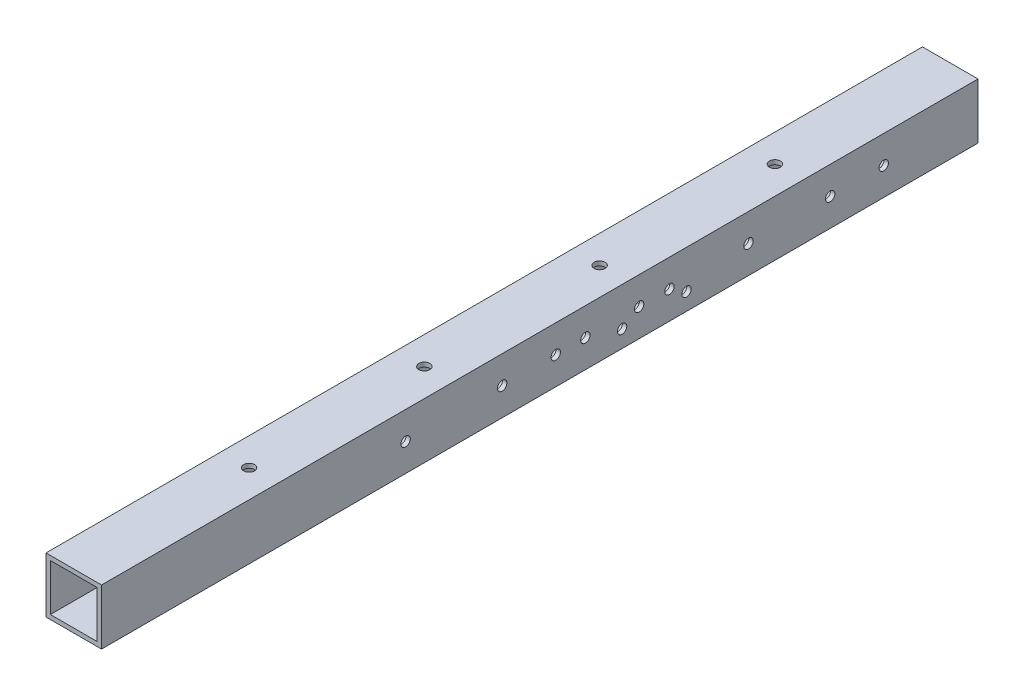
from build123d import *

# Parameters (mm, degrees)
SKETCH_1_W           = 25.4
SKETCH_1_H           = 25.4
EXTRUDE_1_DEPTH      = 400.8
SKETCH_1_3_W         = 21.4
SKETCH_1_3_H         = 21.4
CUT_EXTRUDE_1_DEPTH  = 402.202218339
SKETCH_2_R           = 2.15
CUT_EXTRUDE_2_DEPTH  = 3
SKETCH_3_R           = 2.15
CUT_EXTRUDE_3_DEPTH  = 3
SKETCH_4_R           = 2.15
CUT_EXTRUDE_4_DEPTH  = 3
SKETCH_5_R           = 2.149999993
CUT_EXTRUDE_5_DEPTH  = 5
SKETCH_6_R           = 2.15
CUT_EXTRUDE_6_DEPTH  = 5
SKETCH_7_R           = 2.15
CUT_EXTRUDE_7_DEPTH  = 5
SKETCH_8_R           = 2.15
CUT_EXTRUDE_8_DEPTH  = 5
SKETCH_9_R           = 2.15
CUT_EXTRUDE_9_DEPTH  = 5
SKETCH_10_R          = 2.15
CUT_EXTRUDE_10_DEPTH = 5
SKETCH_12_R          = 2.15
CUT_EXTRUDE_11_DEPTH = 5
SKETCH_13_R          = 2.15
CUT_EXTRUDE_12_DEPTH = 5
SKETCH_14_R          = 2.15
CUT_EXTRUDE_13_DEPTH = 5
SKETCH_15_R          = 2.15
CUT_EXTRUDE_14_DEPTH = 5
SKETCH_16_R          = 2.5
CUT_EXTRUDE_15_DEPTH = 10
SKETCH_17_R          = 2.5
CUT_EXTRUDE_16_DEPTH = 10


with BuildPart() as part:
    # 草圖1 → 填料-伸長1 (new body)
    with BuildSketch(Plane.XY):
        Rectangle(SKETCH_1_W, SKETCH_1_H)
    extrude(amount=EXTRUDE_1_DEPTH)

    # 草圖1<3> → 除料-伸長1 (cut, through all)
    with BuildSketch(Plane.XY):
        Rectangle(SKETCH_1_3_W, SKETCH_1_3_H)
    extrude(amount=CUT_EXTRUDE_1_DEPTH, mode=Mode.SUBTRACT)

    # 草圖2 → 除料-伸長2 (cut)
    with BuildSketch(Plane(origin=(12.7, 0, 0), x_dir=(0, 0, -1), z_dir=(1, 0, 0))):
        with Locations((-43.1, 0)):
            Circle(SKETCH_2_R)
        with Locations((-67.6, 0)):
            Circle(SKETCH_2_R)
    extrude(amount=-CUT_EXTRUDE_2_DEPTH, mode=Mode.SUBTRACT)

    # 草圖3 → 除料-伸長3 (cut)
    with BuildSketch(Plane.XZ.offset(12.7)):
        with Locations((0, 43.1)):
            Circle(SKETCH_3_R)
        with Locations((0, 67.6)):
            Circle(SKETCH_3_R)
    extrude(amount=-CUT_EXTRUDE_3_DEPTH, mode=Mode.SUBTRACT)

    # 草圖4 → 除料-伸長4 (cut)
    with BuildSketch(Plane(origin=(12.7, 0, 0), x_dir=(0, 0, -1), z_dir=(1, 0, 0))):
        with Locations((-104.95, 0)):
            Circle(SKETCH_4_R)
    extrude(amount=-CUT_EXTRUDE_4_DEPTH, mode=Mode.SUBTRACT)

    # 草圖5 → 除料-伸長5 (cut)
    with BuildSketch(Plane.XZ.offset(12.7)):
        with Locations((0, 104.95)):
            Circle(SKETCH_5_R)
    extrude(amount=-CUT_EXTRUDE_5_DEPTH, mode=Mode.SUBTRACT)

    # 草圖6 → 除料-伸長6 (cut)
    with BuildSketch(Plane(origin=(12.7, 0, 0), x_dir=(0, 0, -1), z_dir=(1, 0, 0))):
        with Locations((-141.100000024, 0)):
            Circle(SKETCH_6_R)
    extrude(amount=-CUT_EXTRUDE_6_DEPTH, mode=Mode.SUBTRACT)

    # 草圖7 → 除料-伸長7 (cut)
    with BuildSketch(Plane.XZ.offset(12.7)):
        with Locations((0, 141.100000023)):
            Circle(SKETCH_7_R)
    extrude(amount=-CUT_EXTRUDE_7_DEPTH, mode=Mode.SUBTRACT)

    # 草圖8 → 除料-伸長8 (cut)
    with BuildSketch(Plane.XZ.offset(12.7)):
        with Locations((4.9, 133.3)):
            Circle(SKETCH_8_R)
        with Locations((4.9, 162.75)):
            Circle(SKETCH_8_R)
    extrude(amount=-CUT_EXTRUDE_8_DEPTH, mode=Mode.SUBTRACT)

    # 草圖9 → 除料-伸長9 (cut)
    with BuildSketch(Plane.XZ.offset(12.7)):
        with Locations((0, 154.95)):
            Circle(SKETCH_9_R)
    extrude(amount=-CUT_EXTRUDE_9_DEPTH, mode=Mode.SUBTRACT)

    # 草圖10 → 除料-伸長10 (cut)
    with BuildSketch(Plane(origin=(12.7, 0, 0), x_dir=(0, 0, -1), z_dir=(1, 0, 0))):
        with Locations((-154.95, 0)):
            Circle(SKETCH_10_R)
    extrude(amount=-CUT_EXTRUDE_10_DEPTH, mode=Mode.SUBTRACT)

    # 草圖12 → 除料-伸長11 (cut)
    with BuildSketch(Plane(origin=(12.7, 0, 0), x_dir=(0, 0, -1), z_dir=(1, 0, 0))):
        with Locations((-133.3, -4.9)):
            Circle(SKETCH_12_R)
        with Locations((-162.75, -4.9)):
            Circle(SKETCH_12_R)
    extrude(amount=-CUT_EXTRUDE_11_DEPTH, mode=Mode.SUBTRACT)

    # 草圖13 → 除料-伸長12 (cut)
    with BuildSketch(Plane(origin=(12.7, 0, 0), x_dir=(0, 0, -1), z_dir=(1, 0, 0))):
        with Locations((-179.55, 0)):
            Circle(SKETCH_13_R)
        with Locations((-261.75, 0)):
            Circle(SKETCH_13_R)
    extrude(amount=-CUT_EXTRUDE_12_DEPTH, mode=Mode.SUBTRACT)

    # 草圖14 → 除料-伸長13 (cut)
    with BuildSketch(Plane(origin=(12.7, 0, 0), x_dir=(0, 0, -1), z_dir=(1, 0, 0))):
        with Locations((-193.100000003, 0)):
            Circle(SKETCH_14_R)
        with Locations((-217.600000003, 0)):
            Circle(SKETCH_14_R)
    extrude(amount=-CUT_EXTRUDE_13_DEPTH, mode=Mode.SUBTRACT)

    # 草圖15 → 除料-伸長14 (cut)
    with BuildSketch(Plane.XZ.offset(12.7)):
        with Locations((-8e-09, 193.099999997)):
            Circle(SKETCH_15_R)
        with Locations((-8e-09, 217.599999997)):
            Circle(SKETCH_15_R)
    extrude(amount=-CUT_EXTRUDE_14_DEPTH, mode=Mode.SUBTRACT)

    # 草圖16 → 除料-伸長15 (cut)
    with BuildSketch(Plane(origin=(0, 12.7, 0), x_dir=(1, 0, 0), z_dir=(0, 1, 0))):
        with Locations((0, -240.48)):
            Circle(SKETCH_16_R)
        with Locations((0, -320.64)):
            Circle(SKETCH_16_R)
        with Locations((0, -160.32)):
            Circle(SKETCH_16_R)
        with Locations((0, -80.16)):
            Circle(SKETCH_16_R)
    extrude(amount=-CUT_EXTRUDE_15_DEPTH, mode=Mode.SUBTRACT)

    # 草圖17 → 除料-伸長16 (cut)
    with BuildSketch(Plane.ZY.offset(12.7)):
        with Locations((80.16, 0)):
            Circle(SKETCH_17_R)
        with Locations((160.32, 0)):
            Circle(SKETCH_17_R)
        with Locations((240.48, 0)):
            Circle(SKETCH_17_R)
        with Locations((320.64, 0)):
            Circle(SKETCH_17_R)
    extrude(amount=-CUT_EXTRUDE_16_DEPTH, mode=Mode.SUBTRACT)


solid = part.part
